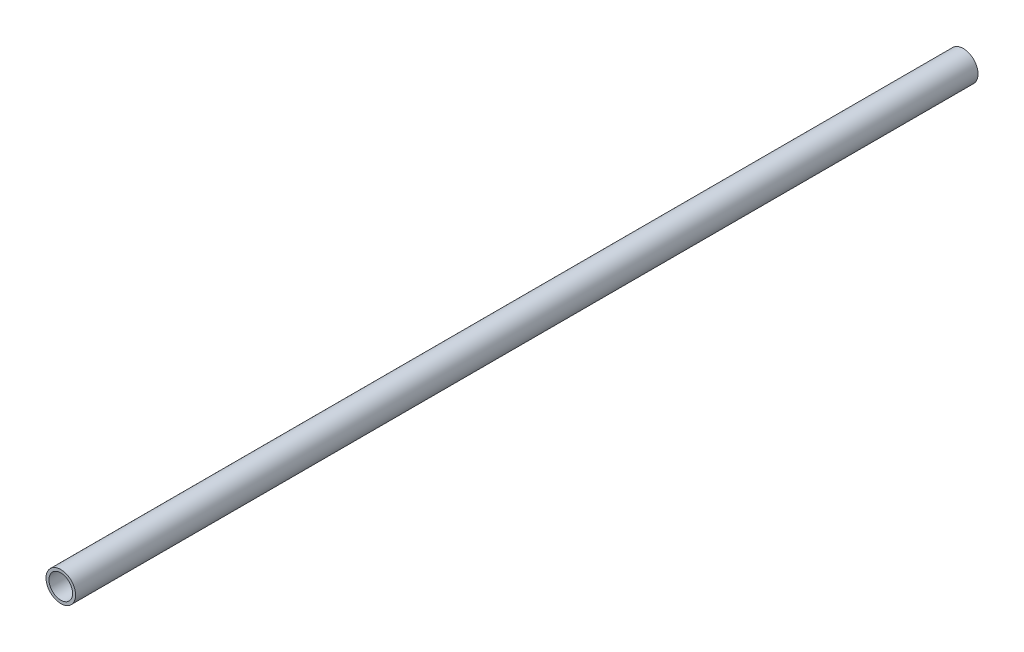
from build123d import *

# Parameters (mm, degrees)
SCHIZZO1_R                   = 15
SCHIZZO1_R_2                 = 12
ESTRUSIONE_ESTRUSIONE1_DEPTH = 458


with BuildPart() as part:
    # Schizzo1 → Estrusione-Estrusione1 (new, symmetric)
    with BuildSketch(Plane.XY):
        with Locations(Location((0, 0, 0), (0, 0, 180))):
            Circle(SCHIZZO1_R)
        with Locations(Location((0, 0, 0), (0, 0, 180))):
            Circle(SCHIZZO1_R_2, mode=Mode.SUBTRACT)
    extrude(amount=ESTRUSIONE_ESTRUSIONE1_DEPTH, both=True)


solid = part.part
